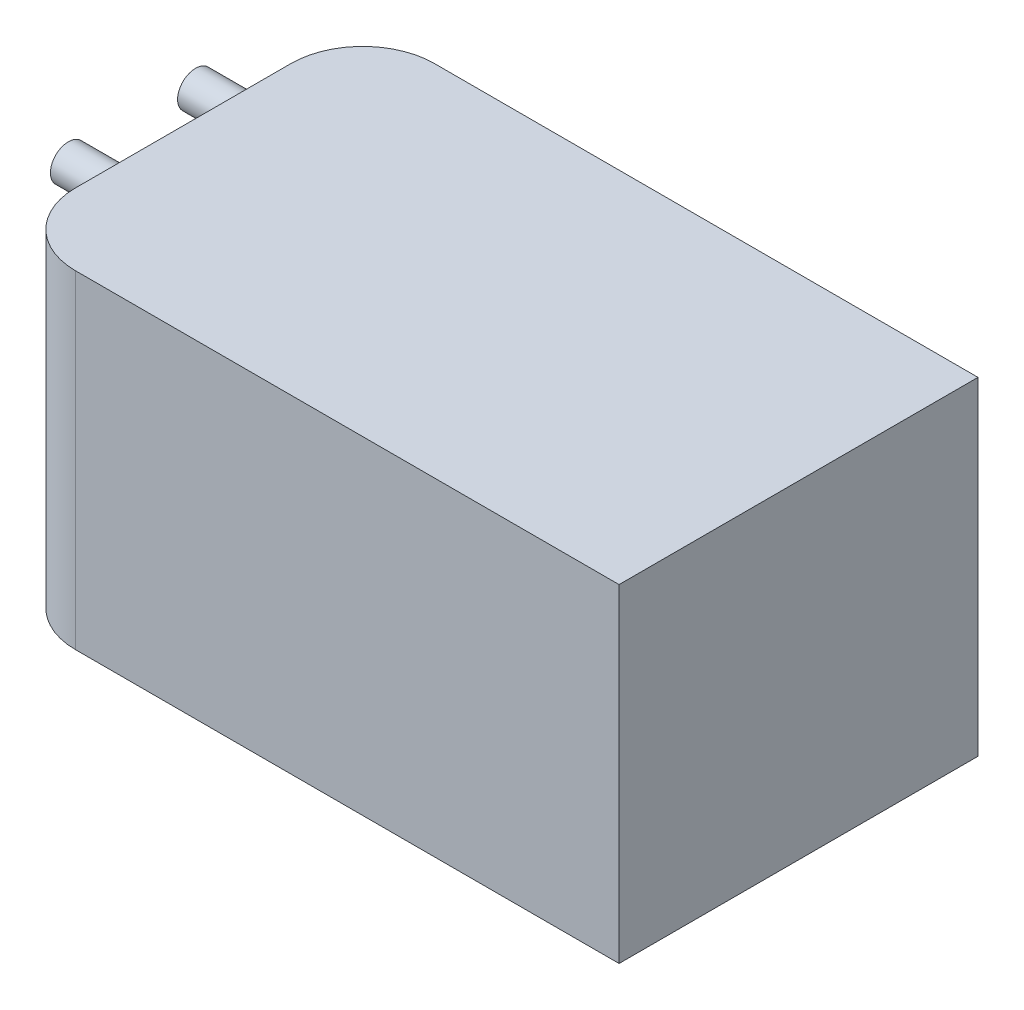
from build123d import *

# Parameters (mm, degrees)
SKETCH1_W           = 60
SKETCH1_H           = 32
BOSS_EXTRUDE1_DEPTH = 35
FILLET1_R           = 7
SKETCH3_R           = 1.75
BOSS_EXTRUDE3_DEPTH = 5


with BuildPart() as part:
    # Sketch1 → Boss-Extrude1 (new body)
    with BuildSketch(Plane.XY):
        Rectangle(SKETCH1_W, SKETCH1_H)
    extrude(amount=BOSS_EXTRUDE1_DEPTH)

    # Fillet1
    fillet1_edges = [part.edges().sort_by_distance(p)[0] for p in [
        (-30, 0, 35),
        (-30, 0, 0),
    ]]
    fillet(fillet1_edges, radius=FILLET1_R)

    # Sketch3 → Boss-Extrude3 (add)
    with BuildSketch(Plane(origin=(-30, 46, 0), x_dir=(0, 1, 0), z_dir=(-1, 0, 0))):
        with Locations(Location((-32.5, -11.3, 0), (0, 0, 90))):
            Circle(SKETCH3_R)
        with Locations(Location((-32.5, -23.7, 0), (0, 0, 90))):
            Circle(SKETCH3_R)
    extrude(amount=BOSS_EXTRUDE3_DEPTH)


solid = part.part
